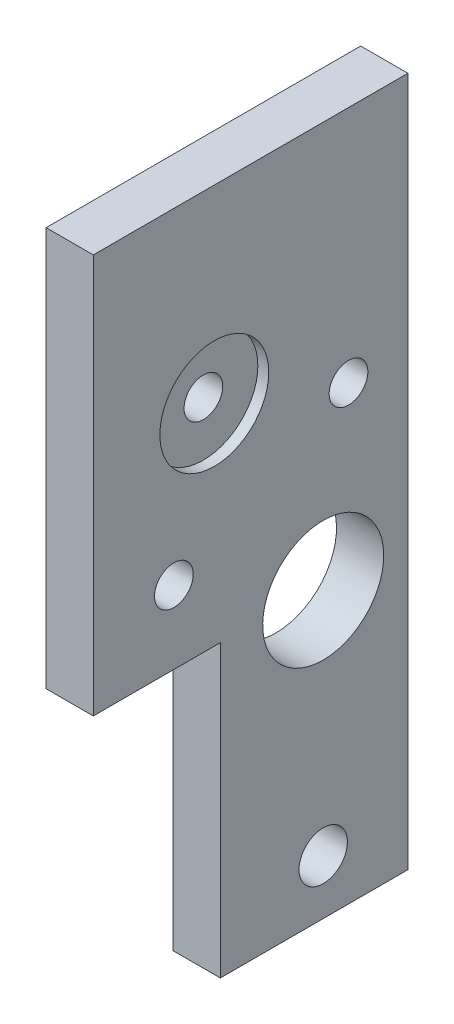
from build123d import *

# Parameters (mm, degrees)
SKETCH1_W                                        = 30
SKETCH1_H                                        = 57
BOSS_EXTRUDE1_DEPTH                              = 4
SKETCH2_R                                        = 5
CUT_EXTRUDE1_DEPTH                               = 65.536811201
F_4_0_4_DIAMETER_HOLE1_D                         = 4
SKETCH12_W                                       = 14.5
SKETCH12_H                                       = 24
CUT_EXTRUDE2_DEPTH                               = 65.536811201
SKETCH13_W                                       = 42.673617324
SKETCH13_H                                       = 65.779819875
CUT_EXTRUDE5_DEPTH                               = 4
F_4_0_4_DIAMETER_HOLE6_D                         = 4
CBORE_FOR_M3_PAN_HEAD_MACHINE_SCREW7_D           = 3.2
CBORE_FOR_M3_PAN_HEAD_MACHINE_SCREW7_CBORE_D     = 9
CBORE_FOR_M3_PAN_HEAD_MACHINE_SCREW7_CBORE_DEPTH = 1
CSK_FOR_M3_FLAT_HEAD_MACHINE_SCREW1_D            = 3.2
CSK_FOR_M3_FLAT_HEAD_MACHINE_SCREW1_CSINK_D      = 4
CSK_FOR_M3_FLAT_HEAD_MACHINE_SCREW1_CSINK_ANGLE  = 90
CUT_EXTRUDE6_DEPTH                               = 65.536811201
CUT_EXTRUDE6_DEPTH_BACK                          = 65.536811201
SKETCH45_W                                       = 4
SKETCH45_H                                       = 33
SKETCH46_W                                       = 0.1
SKETCH46_H                                       = 57
CUT_EXTRUDE7_DEPTH                               = 63.777384463


with BuildPart() as part:
    # Sketch1 → Boss-Extrude1 (new body)
    with BuildSketch(Plane(origin=(0, 0, 0), x_dir=(0, 0, -1), z_dir=(1, 0, 0))):
        with Locations((-15, 28.5)):
            Rectangle(SKETCH1_W, SKETCH1_H)
    boss_extrude1 = extrude(amount=-BOSS_EXTRUDE1_DEPTH)

    # Sketch2 → Cut-Extrude1 (cut, through all)
    with BuildSketch(Plane(origin=(0, 0, 0), x_dir=(0, 0, -1), z_dir=(1, 0, 0))):
        with Locations((-7, 23.5)):
            Circle(SKETCH2_R)
    cut_extrude1 = extrude(amount=-CUT_EXTRUDE1_DEPTH, mode=Mode.SUBTRACT)

    # Ø4.0 (4) Diameter Hole1 (through all)
    with Locations(Plane(origin=(0, 4.5, 7), x_dir=(0, 0, 1), z_dir=(1, 0, 0))):
        with Locations((0, 0)):
            Hole(F_4_0_4_DIAMETER_HOLE1_D / 2)

    # Sketch12 → Cut-Extrude2 (cut, through all)
    with BuildSketch(Plane(origin=(0, 0, 0), x_dir=(0, 0, -1), z_dir=(1, 0, 0))):
        with Locations((-22.75, 12)):
            Rectangle(SKETCH12_W, SKETCH12_H)
    cut_extrude2 = extrude(amount=-CUT_EXTRUDE2_DEPTH, mode=Mode.SUBTRACT)

    # Mirror7: Boss-Extrude1, Cut-Extrude1, Cut-Extrude2 across plane
    add(boss_extrude1.mirror(Plane(origin=(0, 0, 0), x_dir=(0, 0, 1), z_dir=(1, 0, 0))))
    add(cut_extrude1.mirror(Plane(origin=(0, 0, 0), x_dir=(0, 0, 1), z_dir=(1, 0, 0))), mode=Mode.SUBTRACT)
    add(cut_extrude2.mirror(Plane(origin=(0, 0, 0), x_dir=(0, 0, 1), z_dir=(1, 0, 0))), mode=Mode.SUBTRACT)

    # Sketch13 → Cut-Extrude5 (cut)
    with BuildSketch(Plane.ZY.offset(4)):
        with Locations((15.520409967, 28.395918007)):
            Rectangle(SKETCH13_W, SKETCH13_H)
    extrude(amount=-CUT_EXTRUDE5_DEPTH, mode=Mode.SUBTRACT)

    # Ø4.0 (4) Diameter Hole6 (through all)
    with Locations(Plane(origin=(0, 4.5, 7), x_dir=(0, 0, -1), z_dir=(-1, 0, 0))):
        with Locations((0, 0)):
            Hole(F_4_0_4_DIAMETER_HOLE6_D / 2)

    # CBORE for M3 Pan Head Machine Screw7 (through all)
    with Locations(Plane(origin=(4, 41.360571099, 16), x_dir=(0, 0, 1), z_dir=(1, 0, 0))):
        with Locations((0, 0)):
            CounterBoreHole(CBORE_FOR_M3_PAN_HEAD_MACHINE_SCREW7_D / 2, CBORE_FOR_M3_PAN_HEAD_MACHINE_SCREW7_CBORE_D / 2, CBORE_FOR_M3_PAN_HEAD_MACHINE_SCREW7_CBORE_DEPTH)

    # CSK for M3 Flat Head Machine Screw1 (through all)
    with Locations(Plane(origin=(0, 30.032608687, 19.33966579), x_dir=(0, 0, -1), z_dir=(-1, 0, 0))):
        with Locations((0, 0), (14.431341448, -7.272)):
            CounterSinkHole(CSK_FOR_M3_FLAT_HEAD_MACHINE_SCREW1_D / 2, CSK_FOR_M3_FLAT_HEAD_MACHINE_SCREW1_CSINK_D / 2, counter_sink_angle=CSK_FOR_M3_FLAT_HEAD_MACHINE_SCREW1_CSINK_ANGLE)

    # Sketch45 → Cut-Extrude6 (cut, two sides: drawn at the far end of the back side and taken through both)
    with BuildSketch(Plane(origin=(4, 0, 0), x_dir=(0, 0, -1), z_dir=(1, 0, 0)).offset(-CUT_EXTRUDE6_DEPTH_BACK)):
        with Locations((-28, 40.5)):
            Rectangle(SKETCH45_W, SKETCH45_H)
    extrude(amount=CUT_EXTRUDE6_DEPTH + CUT_EXTRUDE6_DEPTH_BACK, mode=Mode.SUBTRACT)

    # Sketch46 → Cut-Extrude7 (cut, through all)
    with BuildSketch(Plane(origin=(0, 0, 0), x_dir=(-1, 0, 0), z_dir=(0, 0, -1))):
        with Locations((-3.95, 28.5)):
            Rectangle(SKETCH46_W, SKETCH46_H)
    extrude(amount=-CUT_EXTRUDE7_DEPTH, mode=Mode.SUBTRACT)


solid = part.part
